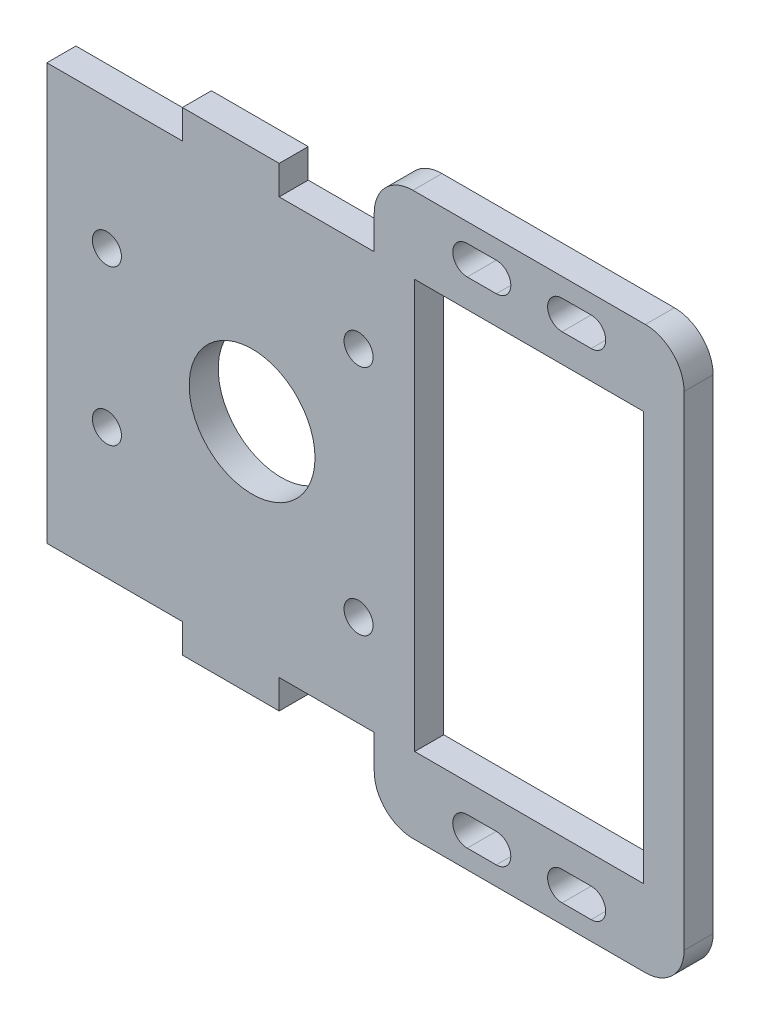
from build123d import *

# Parameters (mm, degrees)
SKETCH1_R           = 1.5
SKETCH1_R_2         = 6.5
SKETCH1_W           = 23.65
SKETCH1_H           = 42.25
BOSS_EXTRUDE1_DEPTH = 3
FILLET1_R           = 4


with BuildPart() as part:
    # Sketch1 → Boss-Extrude1 (new body)
    with BuildSketch(Plane.XY):
        Polygon((12.62, 29), (12.62, 21.5), (2.8, 21.5), (2.8, 24.5), (-7.2, 24.5), (-7.2, 21.5), (-21.2, 21.5), (-21.2, -21.5), (-7.2, -21.5), (-7.2, -24.5), (2.8, -24.5), (2.8, -21.5), (12.62, -21.5), (12.62, -29), (44.63, -29), (44.63, 29), align=None)
        with Locations((-15, -8)):
            Circle(SKETCH1_R, mode=Mode.SUBTRACT)
        with Locations((-15, 8)):
            Circle(SKETCH1_R, mode=Mode.SUBTRACT)
        with Locations((11, 12)):
            Circle(SKETCH1_R, mode=Mode.SUBTRACT)
        with Locations((11, -12)):
            Circle(SKETCH1_R, mode=Mode.SUBTRACT)
        Circle(SKETCH1_R_2, mode=Mode.SUBTRACT)
        with BuildLine():
            Line((22.229319933, 27.05), (25.229319933, 27.05))
            ThreePointArc((25.229319933, 27.05), (26.729319933, 25.55), (25.229319933, 24.05))
            Line((25.229319933, 24.05), (22.229319933, 24.05))
            ThreePointArc((22.229319933, 24.05), (20.729319933, 25.55), (22.229319933, 27.05))
        make_face(mode=Mode.SUBTRACT)
        with BuildLine():
            Line((32.029319933, 27.05), (35.029319933, 27.05))
            ThreePointArc((35.029319933, 27.05), (36.529319933, 25.55), (35.029319933, 24.05))
            Line((35.029319933, 24.05), (32.029319933, 24.05))
            ThreePointArc((32.029319933, 24.05), (30.529319933, 25.55), (32.029319933, 27.05))
        make_face(mode=Mode.SUBTRACT)
        with BuildLine():
            Line((22.229319933, -24.05), (25.229319933, -24.05))
            ThreePointArc((25.229319933, -24.05), (26.729319933, -25.55), (25.229319933, -27.05))
            Line((25.229319933, -27.05), (22.229319933, -27.05))
            ThreePointArc((22.229319933, -27.05), (20.729319933, -25.55), (22.229319933, -24.05))
        make_face(mode=Mode.SUBTRACT)
        with Locations((28.625, 0)):
            Rectangle(SKETCH1_W, SKETCH1_H, mode=Mode.SUBTRACT)
        with BuildLine():
            Line((32.029319933, -24.05), (35.029319933, -24.05))
            ThreePointArc((35.029319933, -24.05), (36.529319933, -25.55), (35.029319933, -27.05))
            Line((35.029319933, -27.05), (32.029319933, -27.05))
            ThreePointArc((32.029319933, -27.05), (30.529319933, -25.55), (32.029319933, -24.05))
        make_face(mode=Mode.SUBTRACT)
    extrude(amount=BOSS_EXTRUDE1_DEPTH)

    # Fillet1
    fillet1_edges = [part.edges().sort_by_distance(p)[0] for p in [
        (44.63, 29, 1.5),
        (12.62, 29, 1.5),
        (12.62, -29, 1.5),
        (44.63, -29, 1.5),
    ]]
    fillet(fillet1_edges, radius=FILLET1_R)


solid = part.part
